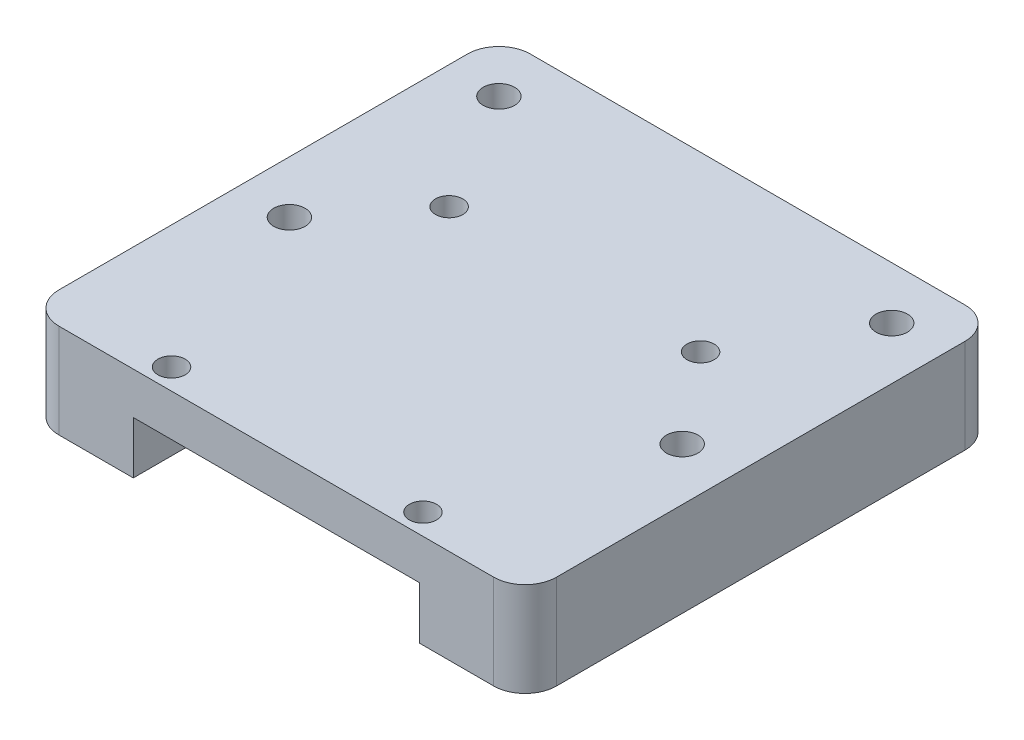
from build123d import *

# Parameters (mm, degrees)
SKETCH_1_W          = 47.5
SKETCH_1_H          = 45
SKETCH_1_R          = 1.5
SKETCH_1_R_2        = 1.3
EXTRUDE_1_DEPTH     = 9
SKETCH_2_W          = 27.3
SKETCH_2_H          = 36
CUT_EXTRUDE_1_DEPTH = 5
FILLET_1_R          = 3


with BuildPart() as part:
    # 草图1 → 凸台-拉伸1 (new body)
    with BuildSketch(Plane(origin=(0, 0, 0), x_dir=(1, 0, 0), z_dir=(0, 1, 0))):
        Rectangle(SKETCH_1_W, SKETCH_1_H)
        with Locations(Location((-18.75, 17.5, 0), (0, 0, 270))):
            Circle(SKETCH_1_R, mode=Mode.SUBTRACT)
        with Locations(Location((-18.75, -2.5, 0), (0, 0, 270))):
            Circle(SKETCH_1_R, mode=Mode.SUBTRACT)
        with Locations(Location((18.75, -2.5, 0), (0, 0, 90))):
            Circle(SKETCH_1_R, mode=Mode.SUBTRACT)
        with Locations(Location((18.75, 17.5, 0), (0, 0, 90))):
            Circle(SKETCH_1_R, mode=Mode.SUBTRACT)
        with Locations(Location((-12, -20.5, 0), (0, 0, 270))):
            Circle(SKETCH_1_R_2, mode=Mode.SUBTRACT)
        with Locations(Location((-12, 6, 0), (0, 0, 270))):
            Circle(SKETCH_1_R_2, mode=Mode.SUBTRACT)
        with Locations(Location((12, 6, 0), (0, 0, 90))):
            Circle(SKETCH_1_R_2, mode=Mode.SUBTRACT)
        with Locations(Location((12, -20.5, 0), (0, 0, 90))):
            Circle(SKETCH_1_R_2, mode=Mode.SUBTRACT)
    extrude(amount=EXTRUDE_1_DEPTH)

    # 草图2 → 切除-拉伸1 (cut)
    with BuildSketch(Plane.XZ):
        with Locations((0, 4.5)):
            Rectangle(SKETCH_2_W, SKETCH_2_H)
    extrude(amount=-CUT_EXTRUDE_1_DEPTH, mode=Mode.SUBTRACT)

    # 圆角1
    fillet_1_edges = [part.edges().sort_by_distance(p)[0] for p in [
        (23.75, 4.5, 22.5),
        (-23.75, 4.5, 22.5),
        (-23.75, 4.5, -22.5),
        (23.75, 4.5, -22.5),
    ]]
    fillet(fillet_1_edges, radius=FILLET_1_R)


solid = part.part
